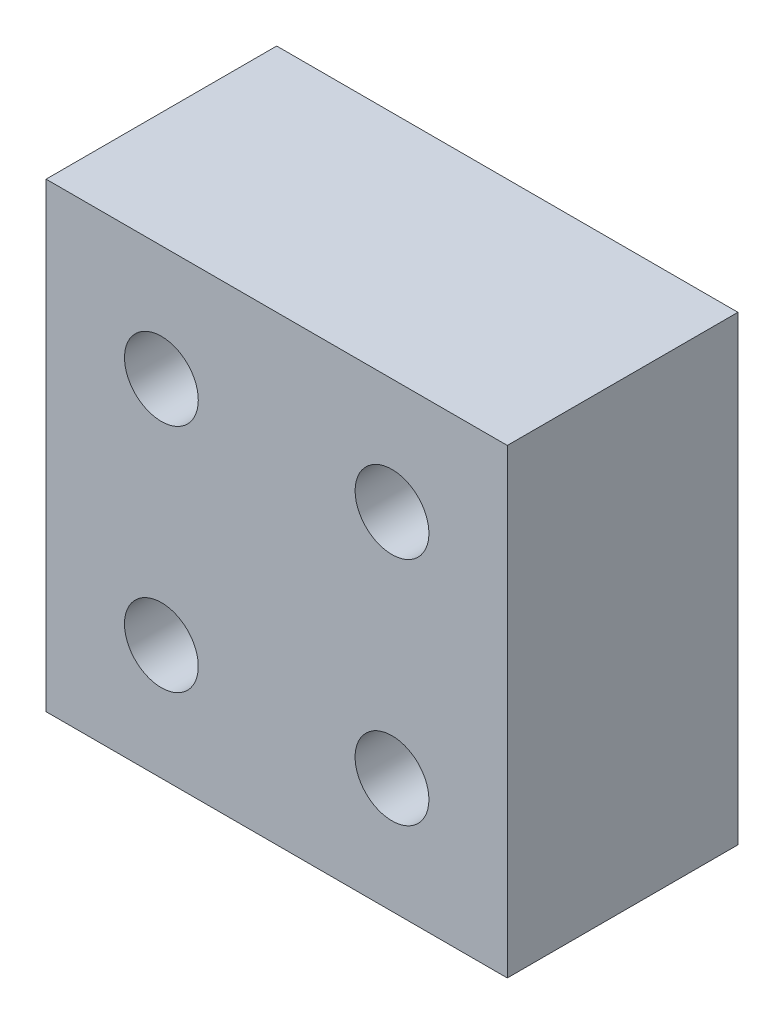
from build123d import *

# Parameters (mm, degrees)
SKETCH_1_W          = 20
SKETCH_1_H          = 20
EXTRUDE_1_DEPTH     = 10
SKETCH_2_R          = 1.6
CUT_EXTRUDE_1_DEPTH = 31


with BuildPart() as part:
    # 草图1 → 凸台-拉伸1 (new body)
    with BuildSketch(Plane.XY):
        with Locations((10, -10)):
            Rectangle(SKETCH_1_W, SKETCH_1_H)
    extrude(amount=EXTRUDE_1_DEPTH)

    # 草图2 → 切除-拉伸1 (cut, through all)
    with BuildSketch(Plane.XY.offset(10)):
        with Locations((5, -5)):
            Circle(SKETCH_2_R)
        with Locations(Location((15, -5, 0), (0, 0, 180))):
            Circle(SKETCH_2_R)
        with Locations((15, -15)):
            Circle(SKETCH_2_R)
        with Locations(Location((5, -15, 0), (0, 0, 180))):
            Circle(SKETCH_2_R)
    extrude(amount=-CUT_EXTRUDE_1_DEPTH, mode=Mode.SUBTRACT)


solid = part.part
